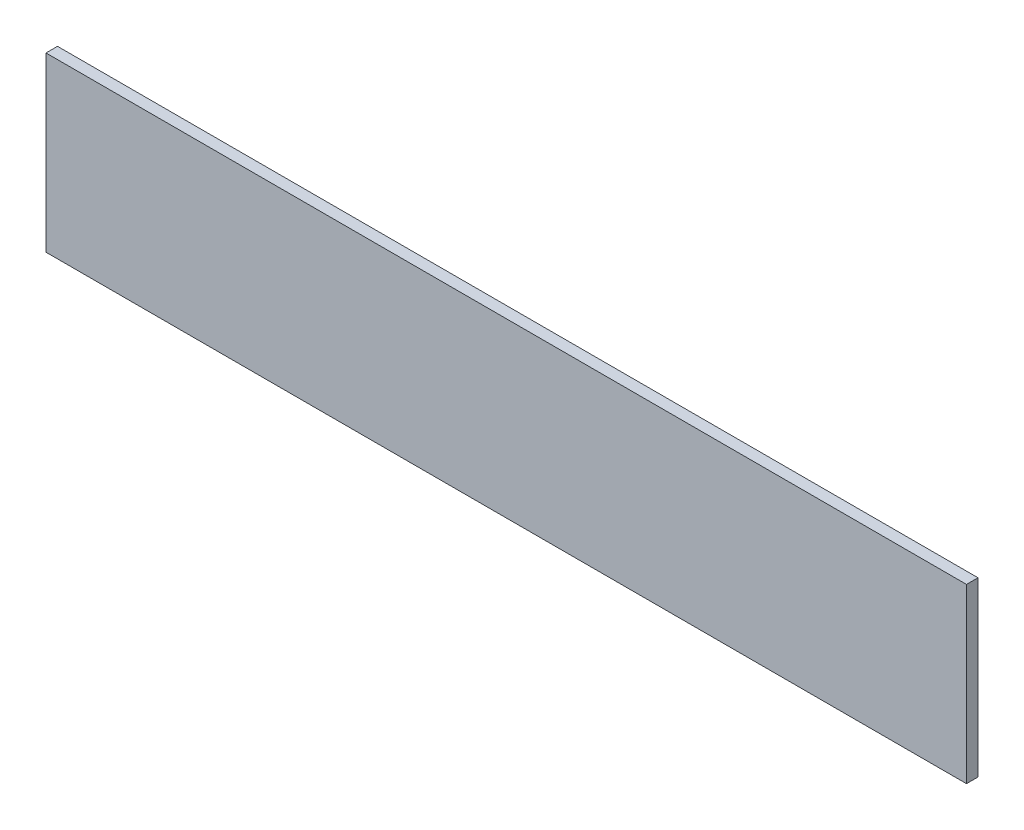
from build123d import *

# Parameters (mm, degrees)
SCHIZZO1_W                   = 160
SCHIZZO1_H                   = 30
ESTRUSIONE_ESTRUSIONE1_DEPTH = 2


with BuildPart() as part:
    # Schizzo1 → Estrusione-Estrusione1 (new body)
    with BuildSketch(Plane.XY):
        with Locations((80, 15)):
            Rectangle(SCHIZZO1_W, SCHIZZO1_H)
    extrude(amount=ESTRUSIONE_ESTRUSIONE1_DEPTH)


solid = part.part
